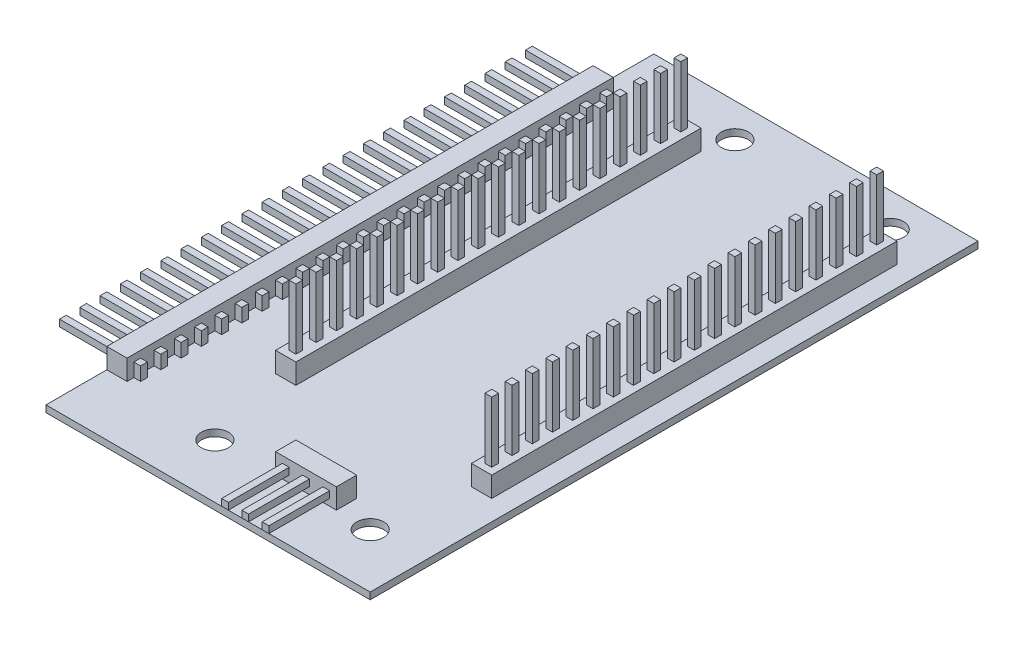
from build123d import *

# Parameters (mm, degrees)
SKETCH1_W           = 38.1
SKETCH1_H           = 71.4375
BOSS_EXTRUDE1_DEPTH = 0.79375
SKETCH2_W           = 0.79375
SKETCH2_H           = 0.79375
BOSS_EXTRUDE2_DEPTH = 0.79375
BOSS_EXTRUDE3_START = 0.79375
SKETCH2_3_W         = 9.525
SKETCH2_3_H         = 0.79375
BOSS_EXTRUDE3_DEPTH = 0.79375
SKETCH3_W           = 2.38125
SKETCH3_H           = 57.15
BOSS_EXTRUDE4_DEPTH = 2.38125
SKETCH4_W           = 0.79375
SKETCH4_H           = 0.79375
BOSS_EXTRUDE5_DEPTH = 9.525
SKETCH5_W           = 2.38125
SKETCH5_H           = 47.625
BOSS_EXTRUDE6_DEPTH = 2.38125
SKETCH6_W           = 0.79375
SKETCH6_H           = 0.79375
BOSS_EXTRUDE7_DEPTH = 0.79375
BOSS_EXTRUDE8_START = 0.79375
SKETCH6_3_W         = 0.79375
SKETCH6_3_H         = 10.31875
BOSS_EXTRUDE8_DEPTH = 0.79375
SKETCH7_W           = 7.14375
SKETCH7_H           = 2.38125
BOSS_EXTRUDE9_DEPTH = 2.38125
SKETCH8_R           = 1.5875
CUT_EXTRUDE1_DEPTH  = 46.486792383


with BuildPart() as part:
    # Sketch1 → Boss-Extrude1 (new body)
    with BuildSketch(Plane(origin=(0, 0, 0), x_dir=(1, 0, 0), z_dir=(0, 1, 0))):
        Rectangle(SKETCH1_W, SKETCH1_H)
    extrude(amount=BOSS_EXTRUDE1_DEPTH)

    # Sketch2 → Boss-Extrude2 (add)
    with BuildSketch(Plane(origin=(0, 0.79375, 0), x_dir=(1, 0, 0), z_dir=(0, 1, 0))):
        with Locations((-16.271875, 1.190625)):
            Rectangle(SKETCH2_W, SKETCH2_H)
        with Locations((-16.271875, 3.571875)):
            Rectangle(SKETCH2_W, SKETCH2_H)
        with Locations((-16.271875, 8.334375)):
            Rectangle(SKETCH2_W, SKETCH2_H)
        with Locations((-16.271875, 5.953125)):
            Rectangle(SKETCH2_W, SKETCH2_H)
        with Locations((-16.271875, 10.715625)):
            Rectangle(SKETCH2_W, SKETCH2_H)
        with Locations((-16.271875, 13.096875)):
            Rectangle(SKETCH2_W, SKETCH2_H)
        with Locations((-16.271875, 15.478125)):
            Rectangle(SKETCH2_W, SKETCH2_H)
        with Locations((-16.271875, 17.859375)):
            Rectangle(SKETCH2_W, SKETCH2_H)
        with Locations((-16.271875, 20.240625)):
            Rectangle(SKETCH2_W, SKETCH2_H)
        with Locations((-16.271875, 22.621875)):
            Rectangle(SKETCH2_W, SKETCH2_H)
        with Locations((-16.271875, 25.003125)):
            Rectangle(SKETCH2_W, SKETCH2_H)
        with Locations((-16.271875, 27.384375)):
            Rectangle(SKETCH2_W, SKETCH2_H)
        with Locations((-16.271875, -27.384375)):
            Rectangle(SKETCH2_W, SKETCH2_H)
        with Locations((-16.271875, -25.003125)):
            Rectangle(SKETCH2_W, SKETCH2_H)
        with Locations((-16.271875, -22.621875)):
            Rectangle(SKETCH2_W, SKETCH2_H)
        with Locations((-16.271875, -17.859375)):
            Rectangle(SKETCH2_W, SKETCH2_H)
        with Locations((-16.271875, -20.240625)):
            Rectangle(SKETCH2_W, SKETCH2_H)
        with Locations((-16.271875, -15.478125)):
            Rectangle(SKETCH2_W, SKETCH2_H)
        with Locations((-16.271875, -13.096875)):
            Rectangle(SKETCH2_W, SKETCH2_H)
        with Locations((-16.271875, -10.715625)):
            Rectangle(SKETCH2_W, SKETCH2_H)
        with Locations((-16.271875, -5.953125)):
            Rectangle(SKETCH2_W, SKETCH2_H)
        with Locations((-16.271875, -8.334375)):
            Rectangle(SKETCH2_W, SKETCH2_H)
        with Locations((-16.271875, -3.571875)):
            Rectangle(SKETCH2_W, SKETCH2_H)
        with Locations((-16.271875, -1.190625)):
            Rectangle(SKETCH2_W, SKETCH2_H)
    extrude(amount=BOSS_EXTRUDE2_DEPTH)

    # Sketch2<3> → Boss-Extrude3 (add)
    with BuildSketch(Plane(origin=(0, 0.79375, 0), x_dir=(1, 0, 0), z_dir=(0, 1, 0)).offset(BOSS_EXTRUDE3_START)):
        with Locations((-20.6375, 1.190625)):
            Rectangle(SKETCH2_3_W, SKETCH2_3_H)
        with Locations((-20.6375, 3.571875)):
            Rectangle(SKETCH2_3_W, SKETCH2_3_H)
        with Locations((-20.6375, 8.334375)):
            Rectangle(SKETCH2_3_W, SKETCH2_3_H)
        with Locations((-20.6375, 5.953125)):
            Rectangle(SKETCH2_3_W, SKETCH2_3_H)
        with Locations((-20.6375, 10.715625)):
            Rectangle(SKETCH2_3_W, SKETCH2_3_H)
        with Locations((-20.6375, 13.096875)):
            Rectangle(SKETCH2_3_W, SKETCH2_3_H)
        with Locations((-20.6375, 15.478125)):
            Rectangle(SKETCH2_3_W, SKETCH2_3_H)
        with Locations((-20.6375, 17.859375)):
            Rectangle(SKETCH2_3_W, SKETCH2_3_H)
        with Locations((-20.6375, 20.240625)):
            Rectangle(SKETCH2_3_W, SKETCH2_3_H)
        with Locations((-20.6375, 22.621875)):
            Rectangle(SKETCH2_3_W, SKETCH2_3_H)
        with Locations((-20.6375, 25.003125)):
            Rectangle(SKETCH2_3_W, SKETCH2_3_H)
        with Locations((-20.6375, 27.384375)):
            Rectangle(SKETCH2_3_W, SKETCH2_3_H)
        with Locations((-20.6375, -27.384375)):
            Rectangle(SKETCH2_3_W, SKETCH2_3_H)
        with Locations((-20.6375, -25.003125)):
            Rectangle(SKETCH2_3_W, SKETCH2_3_H)
        with Locations((-20.6375, -22.621875)):
            Rectangle(SKETCH2_3_W, SKETCH2_3_H)
        with Locations((-20.6375, -20.240625)):
            Rectangle(SKETCH2_3_W, SKETCH2_3_H)
        with Locations((-20.6375, -17.859375)):
            Rectangle(SKETCH2_3_W, SKETCH2_3_H)
        with Locations((-20.6375, -15.478125)):
            Rectangle(SKETCH2_3_W, SKETCH2_3_H)
        with Locations((-20.6375, -13.096875)):
            Rectangle(SKETCH2_3_W, SKETCH2_3_H)
        with Locations((-20.6375, -10.715625)):
            Rectangle(SKETCH2_3_W, SKETCH2_3_H)
        with Locations((-20.6375, -5.953125)):
            Rectangle(SKETCH2_3_W, SKETCH2_3_H)
        with Locations((-20.6375, -8.334375)):
            Rectangle(SKETCH2_3_W, SKETCH2_3_H)
        with Locations((-20.6375, -3.571875)):
            Rectangle(SKETCH2_3_W, SKETCH2_3_H)
        with Locations((-20.6375, -1.190625)):
            Rectangle(SKETCH2_3_W, SKETCH2_3_H)
    extrude(amount=BOSS_EXTRUDE3_DEPTH)

    # Sketch3 → Boss-Extrude4 (add)
    with BuildSketch(Plane(origin=(0, 0.79375, 0), x_dir=(1, 0, 0), z_dir=(0, 1, 0))):
        with Locations((-17.859375, 0)):
            Rectangle(SKETCH3_W, SKETCH3_H)
    extrude(amount=BOSS_EXTRUDE4_DEPTH)

    # Sketch4 → Boss-Extrude5 (add)
    with BuildSketch(Plane(origin=(0, 0.79375, 0), x_dir=(1, 0, 0), z_dir=(0, 1, 0))):
        with Locations((-7.540625, 25.003125)):
            Rectangle(SKETCH4_W, SKETCH4_H)
        with Locations((-7.540625, 22.621875)):
            Rectangle(SKETCH4_W, SKETCH4_H)
        with Locations((-7.540625, 20.240625)):
            Rectangle(SKETCH4_W, SKETCH4_H)
        with Locations((-7.540625, 17.859375)):
            Rectangle(SKETCH4_W, SKETCH4_H)
        with Locations((-7.540625, 15.478125)):
            Rectangle(SKETCH4_W, SKETCH4_H)
        with Locations((-7.540625, 13.096875)):
            Rectangle(SKETCH4_W, SKETCH4_H)
        with Locations((-7.540625, 10.715625)):
            Rectangle(SKETCH4_W, SKETCH4_H)
        with Locations((-7.540625, 8.334375)):
            Rectangle(SKETCH4_W, SKETCH4_H)
        with Locations((-7.540625, 27.384375)):
            Rectangle(SKETCH4_W, SKETCH4_H)
        with Locations((-7.540625, 5.953125)):
            Rectangle(SKETCH4_W, SKETCH4_H)
        with Locations((-7.540625, 3.571875)):
            Rectangle(SKETCH4_W, SKETCH4_H)
        with Locations((-7.540625, -17.859375)):
            Rectangle(SKETCH4_W, SKETCH4_H)
        with Locations((-7.540625, 1.190625)):
            Rectangle(SKETCH4_W, SKETCH4_H)
        with Locations((-7.540625, -1.190625)):
            Rectangle(SKETCH4_W, SKETCH4_H)
        with Locations((-7.540625, -3.571875)):
            Rectangle(SKETCH4_W, SKETCH4_H)
        with Locations((-7.540625, -5.953125)):
            Rectangle(SKETCH4_W, SKETCH4_H)
        with Locations((-7.540625, -8.334375)):
            Rectangle(SKETCH4_W, SKETCH4_H)
        with Locations((-7.540625, -10.715625)):
            Rectangle(SKETCH4_W, SKETCH4_H)
        with Locations((-7.540625, -13.096875)):
            Rectangle(SKETCH4_W, SKETCH4_H)
        with Locations((-7.540625, -15.478125)):
            Rectangle(SKETCH4_W, SKETCH4_H)
        with Locations((15.478125, -15.478125)):
            Rectangle(SKETCH4_W, SKETCH4_H)
        with Locations((15.478125, -13.096875)):
            Rectangle(SKETCH4_W, SKETCH4_H)
        with Locations((15.478125, -10.715625)):
            Rectangle(SKETCH4_W, SKETCH4_H)
        with Locations((15.478125, -8.334375)):
            Rectangle(SKETCH4_W, SKETCH4_H)
        with Locations((15.478125, -5.953125)):
            Rectangle(SKETCH4_W, SKETCH4_H)
        with Locations((15.478125, -3.571875)):
            Rectangle(SKETCH4_W, SKETCH4_H)
        with Locations((15.478125, -1.190625)):
            Rectangle(SKETCH4_W, SKETCH4_H)
        with Locations((15.478125, 1.190625)):
            Rectangle(SKETCH4_W, SKETCH4_H)
        with Locations((15.478125, -17.859375)):
            Rectangle(SKETCH4_W, SKETCH4_H)
        with Locations((15.478125, 3.571875)):
            Rectangle(SKETCH4_W, SKETCH4_H)
        with Locations((15.478125, 5.953125)):
            Rectangle(SKETCH4_W, SKETCH4_H)
        with Locations((15.478125, 27.384375)):
            Rectangle(SKETCH4_W, SKETCH4_H)
        with Locations((15.478125, 8.334375)):
            Rectangle(SKETCH4_W, SKETCH4_H)
        with Locations((15.478125, 10.715625)):
            Rectangle(SKETCH4_W, SKETCH4_H)
        with Locations((15.478125, 13.096875)):
            Rectangle(SKETCH4_W, SKETCH4_H)
        with Locations((15.478125, 15.478125)):
            Rectangle(SKETCH4_W, SKETCH4_H)
        with Locations((15.478125, 17.859375)):
            Rectangle(SKETCH4_W, SKETCH4_H)
        with Locations((15.478125, 20.240625)):
            Rectangle(SKETCH4_W, SKETCH4_H)
        with Locations((15.478125, 22.621875)):
            Rectangle(SKETCH4_W, SKETCH4_H)
        with Locations((15.478125, 25.003125)):
            Rectangle(SKETCH4_W, SKETCH4_H)
    extrude(amount=BOSS_EXTRUDE5_DEPTH)

    # Sketch5 → Boss-Extrude6 (add)
    with BuildSketch(Plane(origin=(0, 0.79375, 0), x_dir=(1, 0, 0), z_dir=(0, 1, 0))):
        with Locations((-7.540625, 4.7625)):
            Rectangle(SKETCH5_W, SKETCH5_H)
        with Locations((15.478125, 4.7625)):
            Rectangle(SKETCH5_W, SKETCH5_H)
    extrude(amount=BOSS_EXTRUDE6_DEPTH)

    # Sketch6 → Boss-Extrude7 (add)
    with BuildSketch(Plane(origin=(0, 0.79375, 0), x_dir=(1, 0, 0), z_dir=(0, 1, 0))):
        with Locations((2.778125, -26.590625)):
            Rectangle(SKETCH6_W, SKETCH6_H)
        with Locations((5.159375, -26.590625)):
            Rectangle(SKETCH6_W, SKETCH6_H)
        with Locations((7.540625, -26.590625)):
            Rectangle(SKETCH6_W, SKETCH6_H)
    extrude(amount=BOSS_EXTRUDE7_DEPTH)

    # Sketch6<3> → Boss-Extrude8 (add)
    with BuildSketch(Plane(origin=(0, 0.79375, 0), x_dir=(1, 0, 0), z_dir=(0, 1, 0)).offset(BOSS_EXTRUDE8_START)):
        with Locations((2.778125, -31.353125)):
            Rectangle(SKETCH6_3_W, SKETCH6_3_H)
        with Locations((5.159375, -31.353125)):
            Rectangle(SKETCH6_3_W, SKETCH6_3_H)
        with Locations((7.540625, -31.353125)):
            Rectangle(SKETCH6_3_W, SKETCH6_3_H)
    extrude(amount=BOSS_EXTRUDE8_DEPTH)

    # Sketch7 → Boss-Extrude9 (add)
    with BuildSketch(Plane(origin=(0, 0.79375, 0), x_dir=(1, 0, 0), z_dir=(0, 1, 0))):
        with Locations((5.159375, -28.178125)):
            Rectangle(SKETCH7_W, SKETCH7_H)
    extrude(amount=BOSS_EXTRUDE9_DEPTH)

    # Sketch8 → Cut-Extrude1 (cut, through all)
    with BuildSketch(Plane(origin=(0, 0.79375, 0), x_dir=(1, 0, 0), z_dir=(0, 1, 0))):
        with Locations((-5.55625, 31.75)):
            Circle(SKETCH8_R)
        with Locations((12.7, 31.75)):
            Circle(SKETCH8_R)
        with Locations((-5.55625, -29.36875)):
            Circle(SKETCH8_R)
        with Locations((12.7, -29.36875)):
            Circle(SKETCH8_R)
    extrude(amount=-CUT_EXTRUDE1_DEPTH, mode=Mode.SUBTRACT)


solid = part.part
